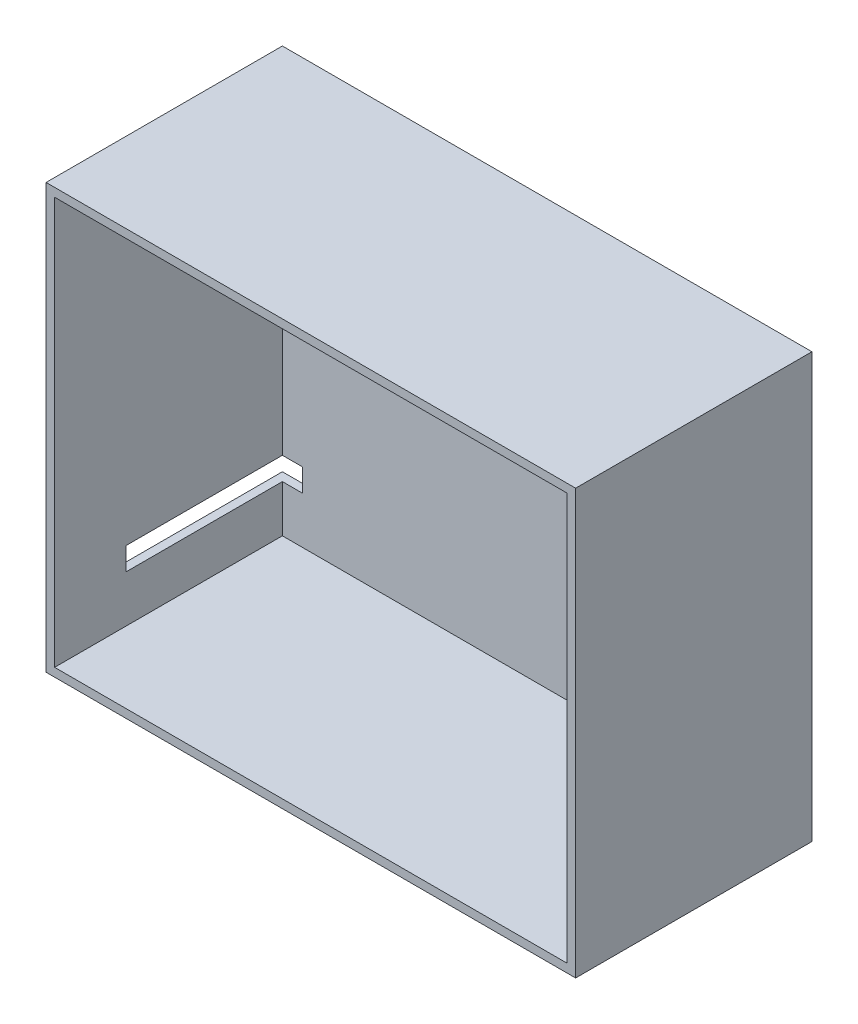
from build123d import *

# Parameters (mm, degrees)
SKETCH_1_W                      = 186
SKETCH_1_H                      = 149
FLOOR_T3_DEPTH                  = 3
SKETCH_2_W                      = 186
SKETCH_2_H                      = 149
SKETCH_2_W_2                    = 180
SKETCH_2_H_2                    = 143
WALLS_T3_DEPTH80_DEPTH          = 83
SKETCH_3_W                      = 11
SKETCH_3_H                      = 8
SERVO_STAND_RELIEF_W8_H58_DEPTH = 58


with BuildPart() as part:
    # 草图1 → Floor_T3 (new body)
    with BuildSketch(Plane.XY):
        with Locations((93, 74.5)):
            Rectangle(SKETCH_1_W, SKETCH_1_H)
    extrude(amount=FLOOR_T3_DEPTH)

    # 草图2 → Walls_T3_depth80 (add)
    with BuildSketch(Plane.XY):
        with Locations((93, 74.5)):
            Rectangle(SKETCH_2_W, SKETCH_2_H)
        with Locations((93, 74.5)):
            Rectangle(SKETCH_2_W_2, SKETCH_2_H_2, mode=Mode.SUBTRACT)
    extrude(amount=WALLS_T3_DEPTH80_DEPTH)

    # 草图3 → Servo_stand_relief_W8_H58 (cut)
    with BuildSketch(Plane.XY):
        with Locations((4.5, 23.5)):
            Rectangle(SKETCH_3_W, SKETCH_3_H)
    extrude(amount=SERVO_STAND_RELIEF_W8_H58_DEPTH, mode=Mode.SUBTRACT)


solid = part.part
